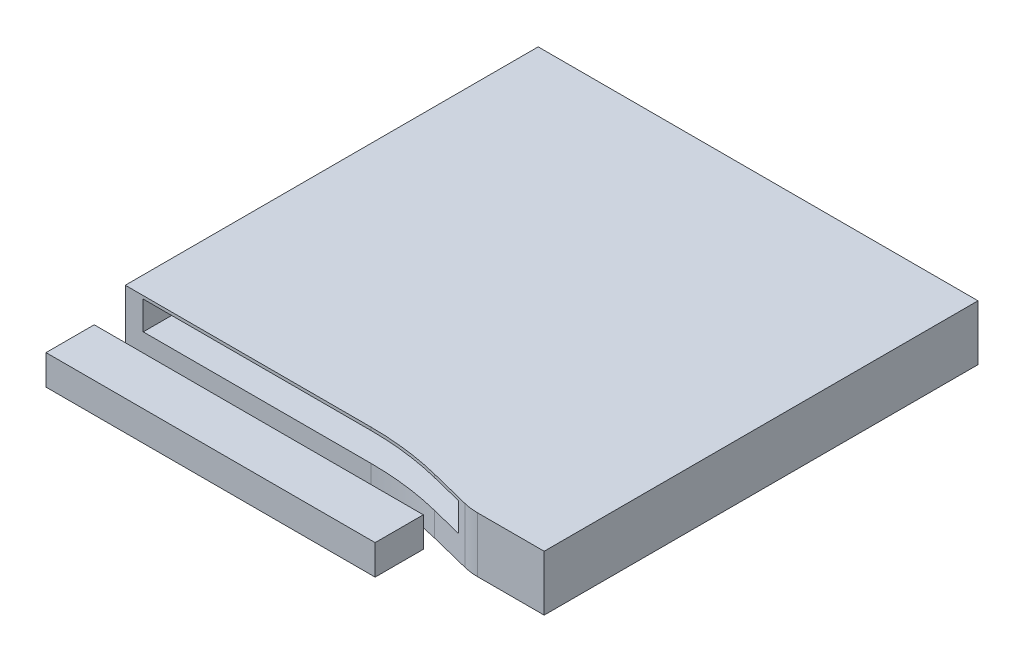
from build123d import *

# Parameters (mm, degrees)
EXTRUDE_1_DEPTH      = 1.85
SKETCH_2_R           = 0.4
EXTRUDE_2_DEPTH      = 0.59
SKETCH_3_W           = 0.3
SKETCH_3_H           = 0.1
EXTRUDE_3_DEPTH      = 0.5
EXTRUDE_3_2_DEPTH    = 0.5
EXTRUDE_3_3_DEPTH    = 0.5
EXTRUDE_3_4_DEPTH    = 0.5
EXTRUDE_3_5_DEPTH    = 0.5
EXTRUDE_3_6_DEPTH    = 0.5
EXTRUDE_3_7_DEPTH    = 0.5
EXTRUDE_3_8_DEPTH    = 0.5
EXTRUDE_3_9_DEPTH    = 0.5
SKETCH_4_W           = 11.1
SKETCH_4_H           = 0.95
CUT_EXTRUDE_1_DEPTH  = 14
EXTRUDE_4_DEPTH      = 0.6
EXTRUDE_4_DEPTH_BACK = 0.4
EXTRUDE_4_START      = -0.575
SKETCH_5_W           = 11
SKETCH_5_H           = 1.611144306


with BuildPart() as part:
    # 草图1 → 凸台-拉伸1 (new body)
    with BuildSketch(Plane(origin=(0, 0, 0), x_dir=(1, 0, 0), z_dir=(0, 1, 0))):
        with BuildLine():
            Line((0, -13.8), (8.206702303, -13.8))
            ThreePointArc((8.206702303, -13.8), (9.432369379, -13.875397226), (10.639554075, -14.100451956))
            Line((10.639554075, -14.100451956), (11.992939368, -14.439909609))
            ThreePointArc((11.992939368, -14.439909609), (12.234376307, -14.484920555), (12.479509723, -14.5))
            Line((12.479509723, -14.5), (14.7, -14.5))
            Line((14.7, -14.5), (14.7, 0))
            Line((14.7, 0), (0, 0))
            Line((0, 0), (0, -13.8))
        make_face()
    extrude(amount=EXTRUDE_1_DEPTH)

    # 草图2 → 凸台-拉伸2 (add)
    with BuildSketch(Plane.XZ):
        with Locations(Location((2.4, 10.5, 0), (0, 0, 90))):
            Circle(SKETCH_2_R)
        with Locations(Location((10.4, 10.5, 0), (0, 0, 90))):
            Circle(SKETCH_2_R)
    extrude(amount=EXTRUDE_2_DEPTH)

    # 草图4 → 切除-拉伸1 (cut)
    with BuildSketch(Plane.XY.offset(14.5)):
        with Locations((6.15, 1.275)):
            Rectangle(SKETCH_4_W, SKETCH_4_H)
    extrude(amount=-CUT_EXTRUDE_1_DEPTH, mode=Mode.SUBTRACT)


with BuildPart() as body_2:
    # 草图3 → 凸台-拉伸3 (new body)
    with BuildSketch(Plane(origin=(0, 0, 0), x_dir=(-1, 0, 0), z_dir=(0, 0, -1))):
        with Locations((-9.6, 0.05)):
            Rectangle(SKETCH_3_W, SKETCH_3_H)
    extrude(amount=EXTRUDE_3_DEPTH)


with BuildPart() as body_3:
    # 草图3 → Extrude 3 2 (new body)
    with BuildSketch(Plane(origin=(0, 0, 0), x_dir=(-1, 0, 0), z_dir=(0, 0, -1))):
        with Locations((-8.5, 0.05)):
            Rectangle(SKETCH_3_W, SKETCH_3_H)
    extrude(amount=EXTRUDE_3_2_DEPTH)


with BuildPart() as body_4:
    # 草图3 → Extrude 3 3 (new body)
    with BuildSketch(Plane(origin=(0, 0, 0), x_dir=(-1, 0, 0), z_dir=(0, 0, -1))):
        with Locations((-7.4, 0.05)):
            Rectangle(SKETCH_3_W, SKETCH_3_H)
    extrude(amount=EXTRUDE_3_3_DEPTH)


with BuildPart() as body_5:
    # 草图3 → Extrude 3 4 (new body)
    with BuildSketch(Plane(origin=(0, 0, 0), x_dir=(-1, 0, 0), z_dir=(0, 0, -1))):
        with Locations((-6.3, 0.05)):
            Rectangle(SKETCH_3_W, SKETCH_3_H)
    extrude(amount=EXTRUDE_3_4_DEPTH)


with BuildPart() as body_6:
    # 草图3 → Extrude 3 5 (new body)
    with BuildSketch(Plane(origin=(0, 0, 0), x_dir=(-1, 0, 0), z_dir=(0, 0, -1))):
        with Locations((-5.2, 0.05)):
            Rectangle(SKETCH_3_W, SKETCH_3_H)
    extrude(amount=EXTRUDE_3_5_DEPTH)


with BuildPart() as body_7:
    # 草图3 → Extrude 3 6 (new body)
    with BuildSketch(Plane(origin=(0, 0, 0), x_dir=(-1, 0, 0), z_dir=(0, 0, -1))):
        with Locations((-4.1, 0.05)):
            Rectangle(SKETCH_3_W, SKETCH_3_H)
    extrude(amount=EXTRUDE_3_6_DEPTH)


with BuildPart() as body_8:
    # 草图3 → Extrude 3 7 (new body)
    with BuildSketch(Plane(origin=(0, 0, 0), x_dir=(-1, 0, 0), z_dir=(0, 0, -1))):
        with Locations((-3, 0.05)):
            Rectangle(SKETCH_3_W, SKETCH_3_H)
    extrude(amount=EXTRUDE_3_7_DEPTH)


with BuildPart() as body_9:
    # 草图3 → Extrude 3 8 (new body)
    with BuildSketch(Plane(origin=(0, 0, 0), x_dir=(-1, 0, 0), z_dir=(0, 0, -1))):
        with Locations((-1.9, 0.05)):
            Rectangle(SKETCH_3_W, SKETCH_3_H)
    extrude(amount=EXTRUDE_3_8_DEPTH)


with BuildPart() as body_10:
    # 草图3 → Extrude 3 9 (new body)
    with BuildSketch(Plane(origin=(0, 0, 0), x_dir=(-1, 0, 0), z_dir=(0, 0, -1))):
        with Locations((-0.8, 0.05)):
            Rectangle(SKETCH_3_W, SKETCH_3_H)
    extrude(amount=EXTRUDE_3_9_DEPTH)


with BuildPart() as body_11:
    # 草图5 → 凸台-拉伸4 (new, two sides: drawn at the far end of the back side and taken through both)
    with BuildSketch(Plane(origin=(0, 1.85, 0), x_dir=(1, 0, 0), z_dir=(0, 1, 0)).offset(EXTRUDE_4_START - EXTRUDE_4_DEPTH_BACK)):
        with Locations((6.15, -16.294427847)):
            Rectangle(SKETCH_5_W, SKETCH_5_H)
    extrude(amount=EXTRUDE_4_DEPTH + EXTRUDE_4_DEPTH_BACK)


solid = Compound([part.part, body_2.part, body_3.part, body_4.part, body_5.part, body_6.part, body_7.part, body_8.part, body_9.part, body_10.part, body_11.part])
